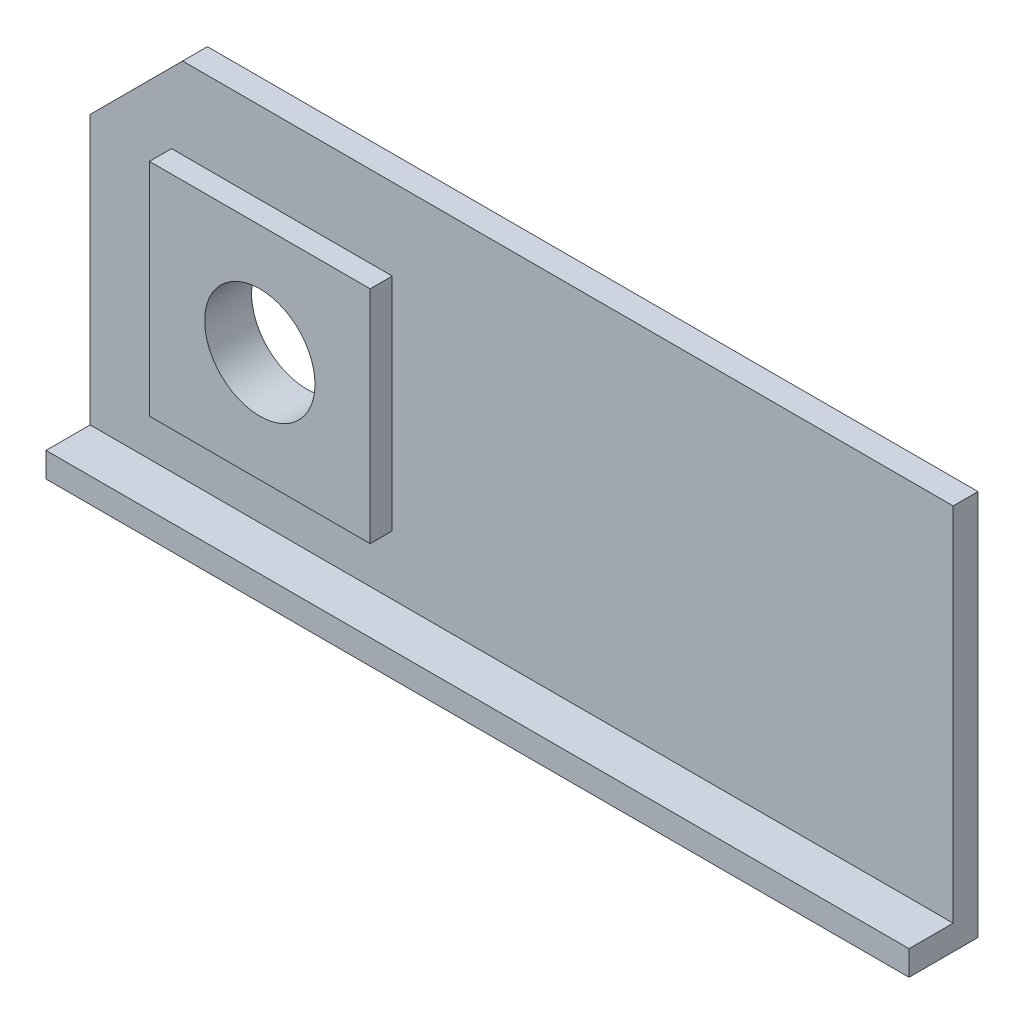
from build123d import *

# Parameters (mm, degrees)
SKETCH2_R           = 10
BOSS_EXTRUDE2_DEPTH = 4.5
SKETCH2_5_W         = 90
SKETCH2_5_H         = 65.5
BOSS_EXTRUDE4_DEPTH = 4.5
BOSS_EXTRUDE5_DEPTH = 12.5
SKETCH4_W           = 40
SKETCH4_H           = 40
SKETCH4_R           = 10
BOSS_EXTRUDE6_DEPTH = 4


with BuildPart() as part:
    # Sketch2 → Boss-Extrude2 (new body)
    with BuildSketch(Plane(origin=(0, 0, 0), x_dir=(-1, 0, 0), z_dir=(0, 0, 1))):
        Polygon((96.758646955, 28.875433948), (96.758646955, -36.624566052), (146.427679381, -36.624566052), (163.18445937, -19.867786064), (163.18445937, 28.875433948), align=None)
        with Locations((128.427679381, -1.867786064)):
            Circle(SKETCH2_R, mode=Mode.SUBTRACT)
    extrude(amount=BOSS_EXTRUDE2_DEPTH)

    # Sketch2<5> → Boss-Extrude4 (add)
    with BuildSketch(Plane(origin=(0, 0, 0), x_dir=(-1, 0, 0), z_dir=(0, 0, 1))):
        with Locations((51.758646955, -3.874566052)):
            Rectangle(SKETCH2_5_W, SKETCH2_5_H)
    extrude(amount=BOSS_EXTRUDE4_DEPTH)

    # Sketch2<7> → Boss-Extrude5 (add)
    with BuildSketch(Plane(origin=(0, 0, 0), x_dir=(-1, 0, 0), z_dir=(0, 0, 1))):
        Polygon((6.758646955, 33.375433948), (6.758646955, 28.875433948), (96.758646955, 28.875433948), (163.18445937, 28.875433948), (163.18445937, 33.375433948), align=None)
    extrude(amount=BOSS_EXTRUDE5_DEPTH)

    # Sketch4 → Boss-Extrude6 (add)
    with BuildSketch(Plane.XY.offset(4.5)):
        with Locations((-128.427679381, 1.867786064)):
            Rectangle(SKETCH4_W, SKETCH4_H)
        with Locations((-128.427679381, 1.867786064)):
            Circle(SKETCH4_R, mode=Mode.SUBTRACT)
    extrude(amount=BOSS_EXTRUDE6_DEPTH)


solid = part.part
